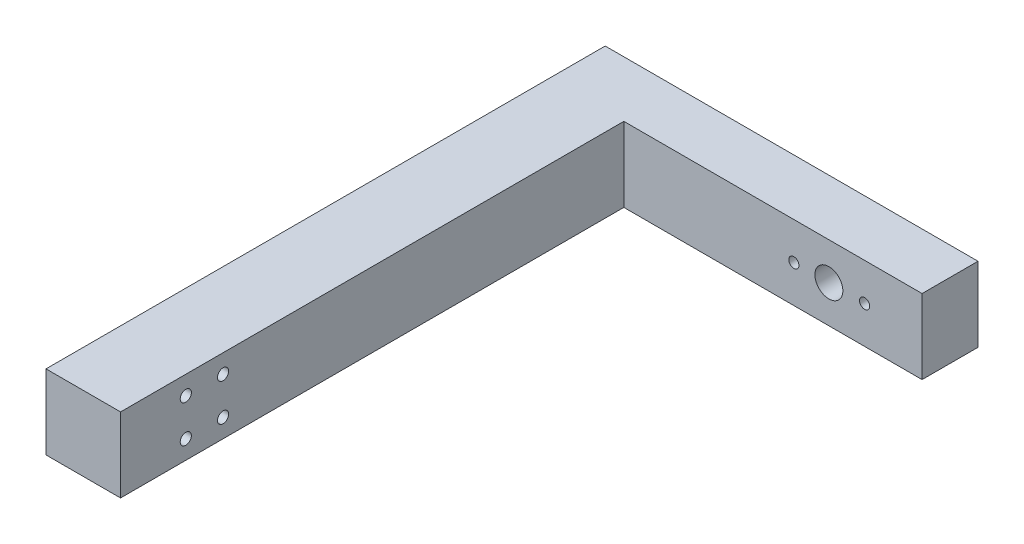
from build123d import *

# Parameters (mm, degrees)
BOSS_EXTRUDE2_DEPTH = 40
SKETCH3_R           = 3
CUT_EXTRUDE1_DEPTH  = 265.256065707
SKETCH4_R           = 3
CUT_EXTRUDE2_DEPTH  = 40
SKETCH5_R           = 7.5
CUT_EXTRUDE3_DEPTH  = 40
SKETCH6_R           = 2.735775354
CUT_EXTRUDE4_DEPTH  = 40


with BuildPart() as part:
    # Sketch2 → Boss-Extrude2 (new body)
    with BuildSketch(Plane(origin=(0, 0, 0), x_dir=(1, 0, 0), z_dir=(0, 1, 0))):
        Polygon((-59.708737864, 220.339805825), (140.291262136, 220.339805825), (140.291262136, 190.339805825), (-19.708737864, 190.339805825), (-19.708737864, -79.660194175), (-59.708737864, -79.660194175), align=None)
    extrude(amount=BOSS_EXTRUDE2_DEPTH)

    # Sketch3 → Cut-Extrude1 (cut, through all)
    with BuildSketch(Plane(origin=(0, 0, 0), x_dir=(0, 0, -1), z_dir=(1, 0, 0))):
        with Locations((-24.660194175, 30)):
            Circle(SKETCH3_R)
        with Locations((-44.660194175, 30)):
            Circle(SKETCH3_R)
    extrude(amount=-CUT_EXTRUDE1_DEPTH, mode=Mode.SUBTRACT)

    # Sketch4 → Cut-Extrude2 (cut)
    with BuildSketch(Plane(origin=(-19.708737864, 0, 0), x_dir=(0, 0, -1), z_dir=(1, 0, 0))):
        with Locations((-44.660194175, 10)):
            Circle(SKETCH4_R)
        with Locations((-24.660194175, 10)):
            Circle(SKETCH4_R)
    extrude(amount=-CUT_EXTRUDE2_DEPTH, mode=Mode.SUBTRACT)

    # Sketch5 → Cut-Extrude3 (cut)
    with BuildSketch(Plane(origin=(0, 0, -220.339805825), x_dir=(-1, 0, 0), z_dir=(0, 0, -1))):
        with Locations((-90.291262136, 20)):
            Circle(SKETCH5_R)
    extrude(amount=-CUT_EXTRUDE3_DEPTH, mode=Mode.SUBTRACT)

    # Sketch6 → Cut-Extrude4 (cut)
    with BuildSketch(Plane(origin=(0, 0, -220.339805825), x_dir=(-1, 0, 0), z_dir=(0, 0, -1))):
        with Locations((-109.465398349, 20)):
            Circle(SKETCH6_R)
        with Locations((-71.49377823, 20)):
            Circle(SKETCH6_R)
    extrude(amount=-CUT_EXTRUDE4_DEPTH, mode=Mode.SUBTRACT)


solid = part.part
